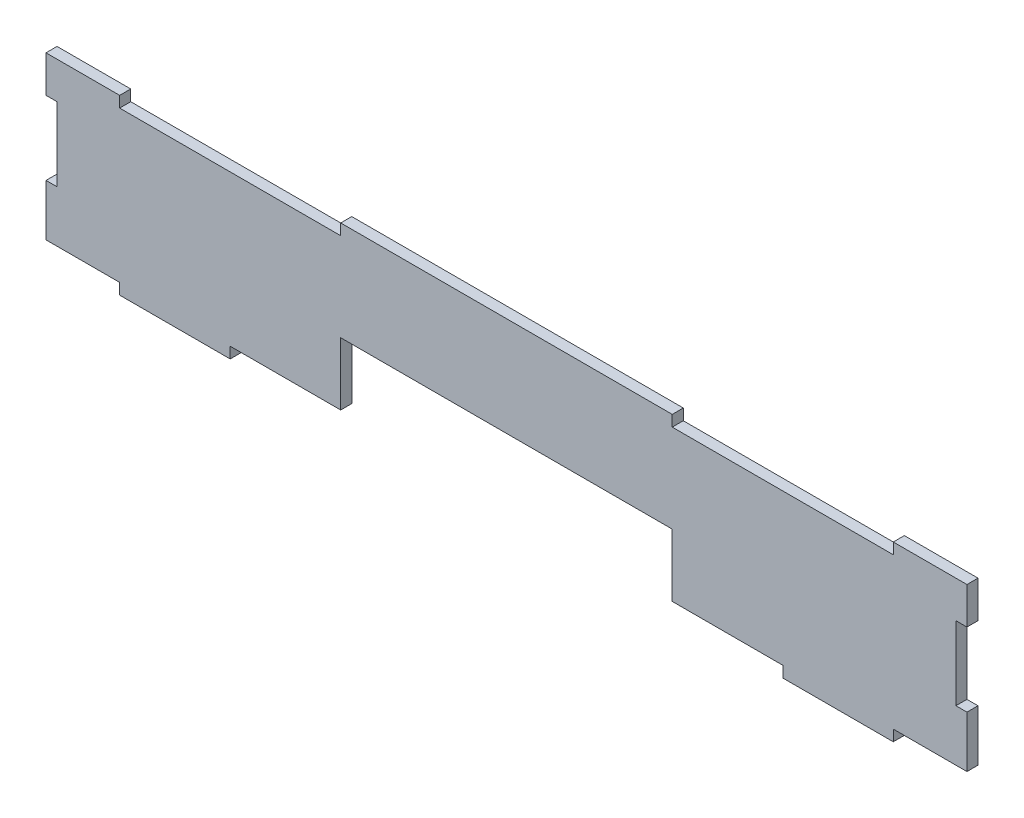
from build123d import *

# Parameters (mm, degrees)
SKETCH1_W           = 250
SKETCH1_H           = 46.98
BOSS_EXTRUDE1_DEPTH = 3
SKETCH2_W           = 3
SKETCH2_H           = 20
CUT_EXTRUDE1_DEPTH  = 255.393632782
SKETCH3_W           = 60
SKETCH3_H           = 3
CUT_EXTRUDE2_DEPTH  = 255.393632782
CUT_EXTRUDE3_REACH  = 256.394
SKETCH4_W           = 90
SKETCH4_H           = 20
SKETCH6_W           = 20
SKETCH6_H           = 3
SKETCH6_W_2         = 30
CUT_EXTRUDE5_DEPTH  = 10


with BuildPart() as part:
    # Sketch1 → Boss-Extrude1 (new body)
    with BuildSketch(Plane.XY):
        with Locations((125, 23.49)):
            Rectangle(SKETCH1_W, SKETCH1_H)
    extrude(amount=BOSS_EXTRUDE1_DEPTH)

    # Sketch2 → Cut-Extrude1 (cut, through all)
    with BuildSketch(Plane.XY.offset(3)):
        with Locations((248.5, 26.98)):
            Rectangle(SKETCH2_W, SKETCH2_H)
        with Locations((1.5, 26.98)):
            Rectangle(SKETCH2_W, SKETCH2_H)
    extrude(amount=-CUT_EXTRUDE1_DEPTH, mode=Mode.SUBTRACT)

    # Sketch3 → Cut-Extrude2 (cut, through all)
    with BuildSketch(Plane.XY.offset(3)):
        with Locations((50, 45.48)):
            Rectangle(SKETCH3_W, SKETCH3_H)
        with Locations((200, 45.48)):
            Rectangle(SKETCH3_W, SKETCH3_H)
    extrude(amount=-CUT_EXTRUDE2_DEPTH, mode=Mode.SUBTRACT)

    # Sketch4 → Cut-Extrude3 (cut, up to next)
    with BuildSketch(Plane(origin=(0, 0, 0), x_dir=(-1, 0, 0), z_dir=(0, 0, -1)), mode=Mode.PRIVATE) as cut_extrude3_sk1:
        with Locations((-125, 10)):
            Rectangle(SKETCH4_W, SKETCH4_H)
    cut_extrude3_tool1 = extrude(cut_extrude3_sk1.sketch, amount=-CUT_EXTRUDE3_REACH, mode=Mode.PRIVATE) & part.part
    add(cut_extrude3_tool1.solids().sort_by_distance((125, 10, 0))[0], mode=Mode.SUBTRACT)

    # Sketch6 → Cut-Extrude5 (cut)
    with BuildSketch(Plane.XY.offset(3)):
        with Locations((10, 1.5)):
            Rectangle(SKETCH6_W, SKETCH6_H)
        with Locations((65, 1.5)):
            Rectangle(SKETCH6_W_2, SKETCH6_H)
        with Locations((240, 1.5)):
            Rectangle(SKETCH6_W, SKETCH6_H)
        with Locations((185, 1.5)):
            Rectangle(SKETCH6_W_2, SKETCH6_H)
    extrude(amount=-CUT_EXTRUDE5_DEPTH, mode=Mode.SUBTRACT)


solid = part.part
